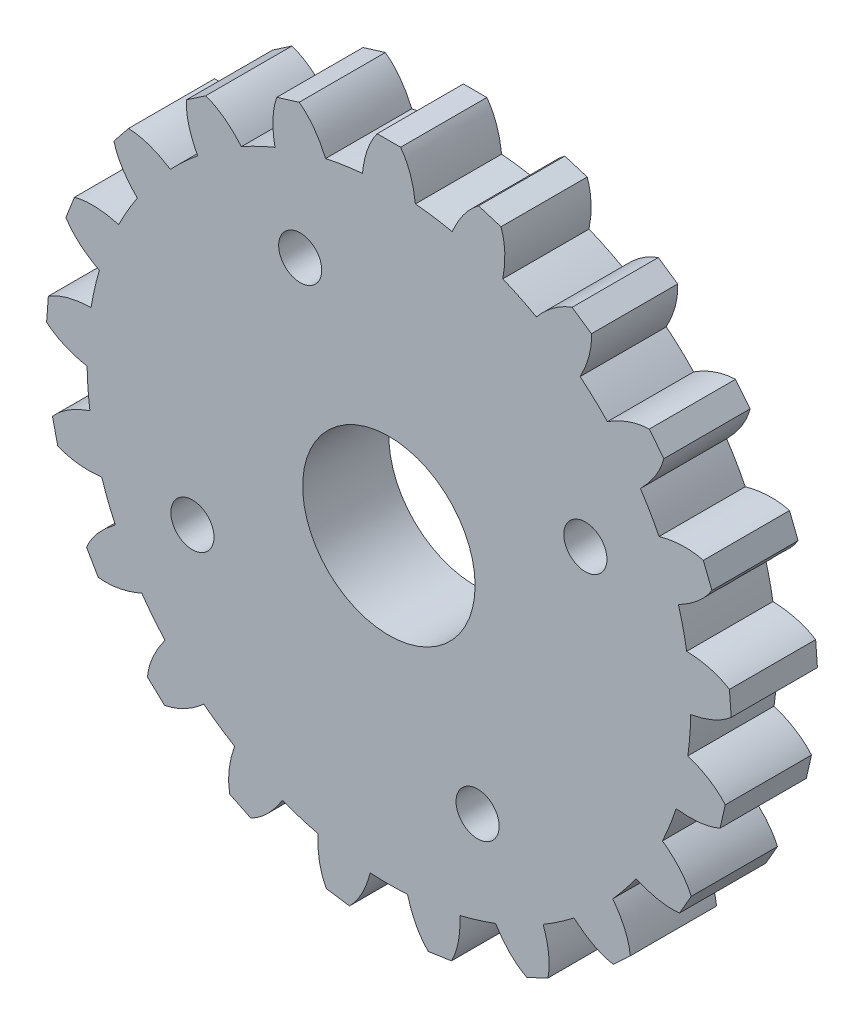
from build123d import *

# Parameters (mm, degrees)
SKIZZE1_R                       = 10.5
AUFSATZ_LINEAR_AUSTRAGEN1_DEPTH = 3
AUFSATZ_LINEAR_AUSTRAGEN2_DEPTH = 3
KREISMUSTER1_COUNT              = 21
SKIZZE3_R                       = 0.75
SCHNITT_LINEAR_AUSTRAGEN1_DEPTH = 6.1
SKIZZE4_R                       = 3
SCHNITT_LINEAR_AUSTRAGEN2_DEPTH = 6.1


with BuildPart() as part:
    # Skizze1 → Aufsatz-Linear austragen1 (new body)
    with BuildSketch(Plane.XY):
        Circle(SKIZZE1_R)
    extrude(amount=AUFSATZ_LINEAR_AUSTRAGEN1_DEPTH)

    # Skizze2 → Aufsatz-Linear austragen2 (add)
    with BuildSketch(Plane.XY.offset(3)):
        with BuildLine():
            Line((0.920961993, 10.459532925), (-0.920961993, 10.459532925))
            add(Edge.make_bspline(
                [(-0.407740146, 11.911843377), (-0.824906562, 11.350994541), (-0.920961993, 10.459532925)],
                knots=[0, 0, 0, 1, 1, 1], degree=2))
            Line((-0.407740146, 11.911843377), (0.407740146, 11.911843377))
            add(Edge.make_bspline(
                [(0.407740146, 11.911843377), (0.824906562, 11.350994541), (0.920961993, 10.459532925)],
                knots=[0, 0, 0, 1, 1, 1], degree=2))
        make_face()
    aufsatz_linear_austragen2 = extrude(amount=-AUFSATZ_LINEAR_AUSTRAGEN2_DEPTH)

    # Kreismuster1: Aufsatz-Linear austragen2 ×21 about axis
    kreismuster1_axis = Axis((0, 0, 3), (0, 0, 1))
    for i in range(1, KREISMUSTER1_COUNT):
        add(aufsatz_linear_austragen2.rotate(kreismuster1_axis, i * 360 / KREISMUSTER1_COUNT))

    # Skizze3 → Schnitt-Linear austragen1 (cut)
    with BuildSketch(Plane.XY.offset(3)):
        with Locations((-3.085747028, 6.835800266)):
            Circle(SKIZZE3_R)
        with Locations((6.835800266, 3.085747028)):
            Circle(SKIZZE3_R)
        with Locations((-6.835800266, -3.085747028)):
            Circle(SKIZZE3_R)
        with Locations((3.085747028, -6.835800266)):
            Circle(SKIZZE3_R)
    extrude(amount=-SCHNITT_LINEAR_AUSTRAGEN1_DEPTH, mode=Mode.SUBTRACT)

    # Skizze4 → Schnitt-Linear austragen2 (cut)
    with BuildSketch(Plane.XY.offset(3)):
        Circle(SKIZZE4_R)
    extrude(amount=-SCHNITT_LINEAR_AUSTRAGEN2_DEPTH, mode=Mode.SUBTRACT)


solid = part.part
